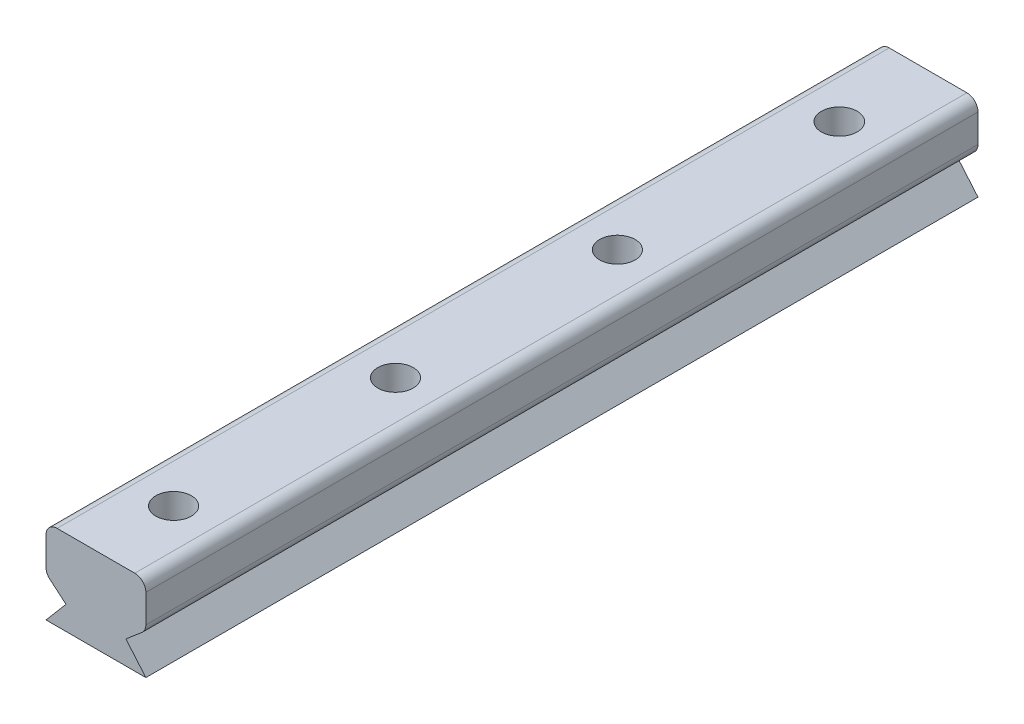
from build123d import *

# Parameters (mm, degrees)
EXTRUDE_1_DEPTH     = 75
FILLET_1_R          = 1
FILLET_2_R          = 1
SKETCH_2_R          = 1.6
SKETCH_2_R_2        = 1.617183579
CUT_EXTRUDE_1_DEPTH = 14


with BuildPart() as part:
    # 草图1 → 凸台-拉伸1 (new body)
    with BuildSketch(Plane.XY):
        Polygon((0, 0), (9, 0), (9, -4), (7.2, -5.529317293), (9, -7.647909697), (0, -7.647909697), (1.8, -5.529317293), (0, -4), align=None)
    extrude(amount=EXTRUDE_1_DEPTH)

    # 圆角1
    fillet_1_edges = [part.edges().sort_by_distance(p)[0] for p in [
        (0, 0, 37.5),
        (9, 0, 37.5),
    ]]
    fillet(fillet_1_edges, radius=FILLET_1_R)

    # 圆角2
    fillet_2_edges = [part.edges().sort_by_distance(p)[0] for p in [
        (9, -4, 37.5),
        (0, -4, 37.5),
    ]]
    fillet(fillet_2_edges, radius=FILLET_2_R)

    # 草图2 → 切除-拉伸1 (cut)
    with BuildSketch(Plane.XZ.offset(7.647909697)):
        with Locations(Location((4.5, 68, 0), (0, 0, 270))):
            Circle(SKETCH_2_R)
        with Locations(Location((4.5, 48, 0), (0, 0, 270))):
            Circle(SKETCH_2_R)
        with Locations(Location((4.5, 28, 0), (0, 0, 270))):
            Circle(SKETCH_2_R)
        with Locations(Location((4.5, 8, 0), (0, 0, 270))):
            Circle(SKETCH_2_R_2)
    extrude(amount=-CUT_EXTRUDE_1_DEPTH, mode=Mode.SUBTRACT)


solid = part.part
